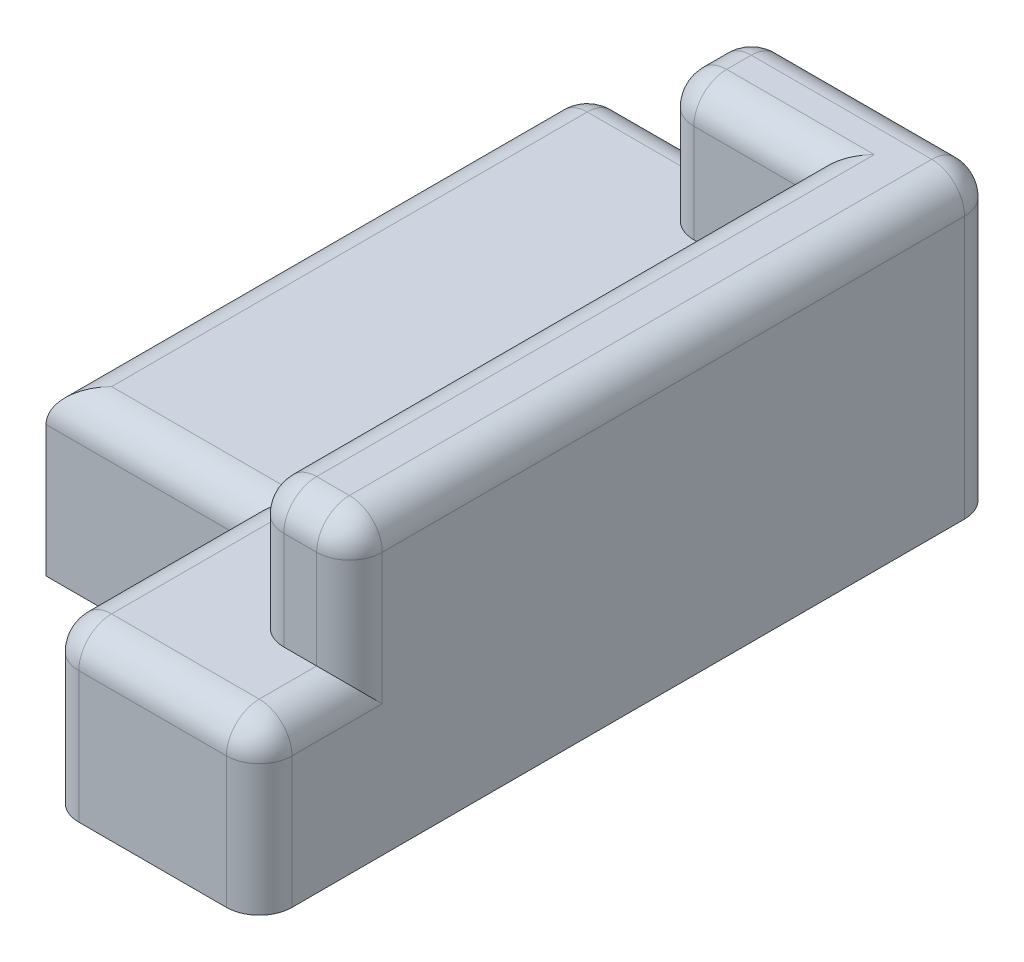
from build123d import *

# Parameters (mm, degrees)
ESBO_O1_W                      = 25
ESBO_O1_H                      = 45
RESSALTO_EXTRUS_O1_DEPTH       = 10
RESSALTO_EXTRUS_O2_DEPTH       = 28
ESBO_O3_W                      = 25
ESBO_O3_H                      = 45
RESSALTO_EXTRUS_O3_DEPTH       = 6
FURO_DE_DI_METRO_4_0_4_1_D     = 4
FURO_DE_DI_METRO_4_0_4_1_DEPTH = 5
FURO_DE_DI_METRO_4_0_4_1_TIP   = 1.201721238
ESBO_O7_W                      = 10
ESBO_O7_H                      = 28
CORTE_EXTRUS_O2_DEPTH          = 5.5
ESBO_O8_W                      = 12
ESBO_O8_H                      = 12
CORTE_EXTRUS_O3_DEPTH          = 12
CORTE_EXTRUS_O4_DEPTH          = 68.720011813
FILETE2_R                      = 2


with BuildPart() as part:
    # Esboço1 → Ressalto-extrusão1 (new body)
    with BuildSketch(Plane(origin=(0, 0, 0), x_dir=(1, 0, 0), z_dir=(0, 1, 0))):
        with Locations((12.5, 22.5)):
            Rectangle(ESBO_O1_W, ESBO_O1_H)
    extrude(amount=RESSALTO_EXTRUS_O1_DEPTH)

    # Esboço2 → Ressalto-extrusão2 (add)
    with BuildSketch(Plane(origin=(0, 10, 0), x_dir=(1, 0, 0), z_dir=(0, 1, 0))):
        Polygon((0, 39.5), (19, 39.5), (19, 5.5), (0, 5.5), (0, 0), (25, 0), (25, 39.5), (25, 45), (0, 45), align=None)
    extrude(amount=RESSALTO_EXTRUS_O2_DEPTH)

    # Esboço3 → Ressalto-extrusão3 (add)
    with BuildSketch(Plane(origin=(0, 38, 0), x_dir=(1, 0, 0), z_dir=(0, 1, 0))):
        with Locations((12.5, 22.5)):
            Rectangle(ESBO_O3_W, ESBO_O3_H)
    extrude(amount=RESSALTO_EXTRUS_O3_DEPTH)

    # Furo de diâmetro Ø4.0 (4)1
    with Locations(Plane(origin=(15, 0, -10), x_dir=(0, 0, -1), z_dir=(0, -1, 0))):
        with Locations((0, 0), (32, 5), (32, -10)):
            Hole(FURO_DE_DI_METRO_4_0_4_1_D / 2, depth=FURO_DE_DI_METRO_4_0_4_1_DEPTH)
            with Locations((0, 0, -(FURO_DE_DI_METRO_4_0_4_1_DEPTH + FURO_DE_DI_METRO_4_0_4_1_TIP / 2))):  # 118° drill point
                Cone(0, FURO_DE_DI_METRO_4_0_4_1_D / 2, FURO_DE_DI_METRO_4_0_4_1_TIP, mode=Mode.SUBTRACT)

    # Esboço7 → Corte-extrusão2 (cut)
    with BuildSketch(Plane(origin=(0, 0, -45), x_dir=(-1, 0, 0), z_dir=(0, 0, -1))):
        with Locations((-5, 24)):
            Rectangle(ESBO_O7_W, ESBO_O7_H)
    extrude(amount=-CORTE_EXTRUS_O2_DEPTH, mode=Mode.SUBTRACT)

    # Esboço8 → Corte-extrusão3 (cut)
    with BuildSketch(Plane.ZY):
        with Locations((-6, 6)):
            Rectangle(ESBO_O8_W, ESBO_O8_H)
    extrude(amount=-CORTE_EXTRUS_O3_DEPTH, mode=Mode.SUBTRACT)

    # Esboço9 → Corte-extrusão4 (cut, through all)
    with BuildSketch(Plane.ZY):
        Polygon((-45, 44), (-45, 18), (-5.5, 18), (-5.5, 10), (0, 10), (0, 44), align=None)
    extrude(amount=-CORTE_EXTRUS_O4_DEPTH, mode=Mode.SUBTRACT)

    # Filete2
    filete2_edges = [part.edges().sort_by_distance(p)[0] for p in [
        (10, 14, -45),
        (10, 18, -42.25),
        (25, 9, -45),
        (25, 5, 0),
        (22, 18, -5.5),
        (19, 18, -22.5),
        (14.5, 18, -39.5),
        (25, 18, -25.25),
        (19, 14, -5.5),
        (25, 14, -5.5),
        (25, 10, -2.75),
        (18.5, 10, 0),
        (17.5, 18, -45),
        (0, 5, -45),
        (5, 10, -45),
        (10, 14, -39.5),
        (0, 10, -28.5),
        (6, 10, -12),
        (12, 5, 0),
        (12, 10, -6),
    ]]
    fillet(filete2_edges, radius=FILETE2_R)


solid = part.part
